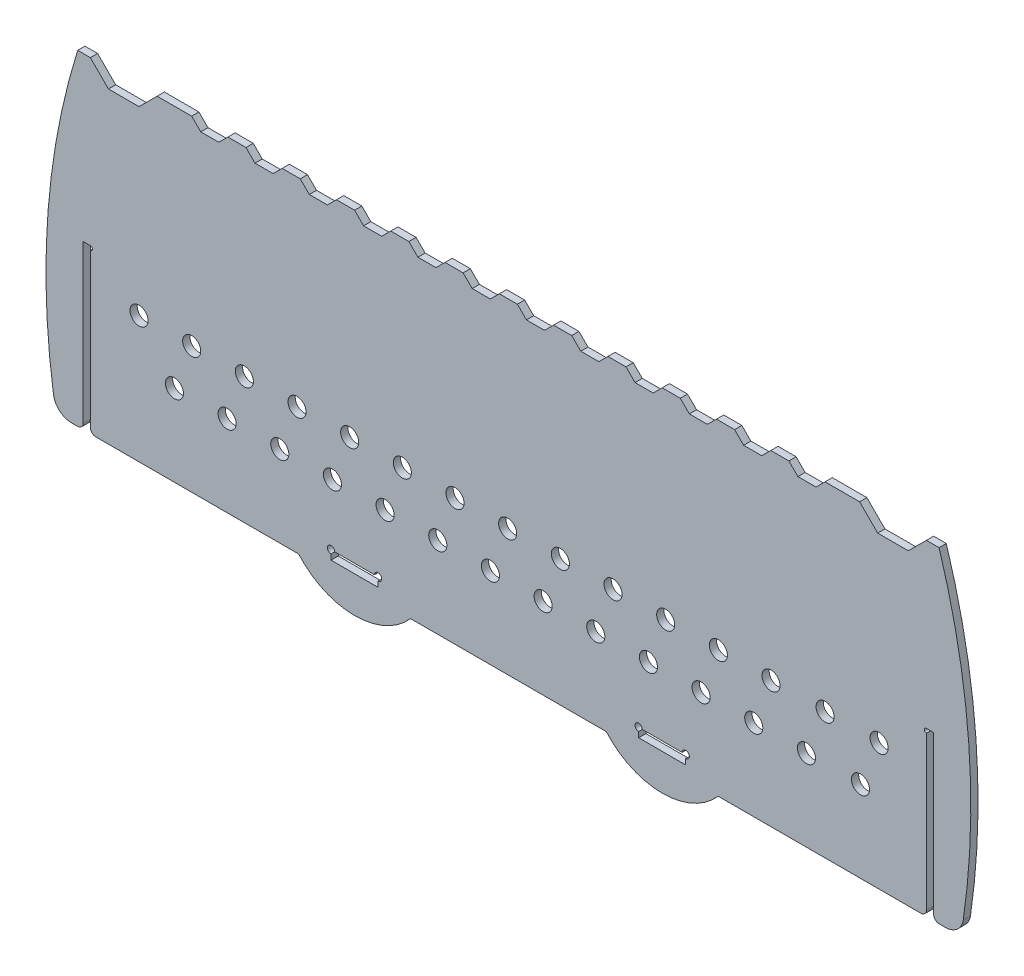
from build123d import *

# Parameters (mm, degrees)
SKETCH_1_R      = 5
EXTRUDE_1_DEPTH = 4


with BuildPart() as part:
    # Эскиз1 → Бобышка-Вытянуть1 (new body)
    with BuildSketch(Plane.XY):
        with BuildLine():
            Line((8.526879851, 0), (12, 0))
            ThreePointArc((12, 0), (14.121320344, 0.878679656), (15, 3))
            Line((15, 3), (15, 90))
            Line((15, 90), (19, 90))
            ThreePointArc((19, 90), (20.154255418, 88.845744582), (19, 87.691489165))
            Line((19, 87.691489165), (19, 3))
            ThreePointArc((19, 3), (19.878679656, 0.878679656), (22, 0))
            Line((22, 0), (134.07411748, 0))
            ThreePointArc((134.07411748, 0), (165, -14), (195.92588252, 0))
            Line((195.92588252, 0), (304.07411748, 0))
            ThreePointArc((304.07411748, 0), (335, -14), (365.92588252, 0))
            Line((365.92588252, 0), (478, 0))
            ThreePointArc((478, 0), (480.121320344, 0.878679656), (481, 3))
            Line((481, 3), (481, 87.691489165))
            ThreePointArc((481, 87.691489165), (479.845744582, 88.845744582), (481, 90))
            Line((481, 90), (485, 90))
            Line((485, 90), (485, 3))
            ThreePointArc((485, 3), (485.878679656, 0.878679656), (488, 0))
            Line((488, 0), (491.473120149, 0))
            ThreePointArc((491.473120149, 0), (498.004324615, 2.427459592), (501.364682095, 8.531326355))
            ThreePointArc((501.364682095, 8.531326355), (504.376413281, 95.021242555), (488, 180))
            Line((488, 180), (481, 180))
            Line((481, 180), (471, 170))
            Line((471, 170), (454.102752641, 170))
            Line((454.102752641, 170), (444.102752641, 180))
            Line((444.102752641, 180), (425, 180))
            Line((425, 180), (420, 175))
            Line((420, 175), (410, 175))
            Line((410, 175), (405, 180))
            Line((405, 180), (395, 180))
            Line((395, 180), (390, 175))
            Line((390, 175), (380, 175))
            Line((380, 175), (375, 180))
            Line((375, 180), (365, 180))
            Line((365, 180), (360, 175))
            Line((360, 175), (350, 175))
            Line((350, 175), (345, 180))
            Line((345, 180), (335, 180))
            Line((335, 180), (330, 175))
            Line((330, 175), (320, 175))
            Line((320, 175), (315, 180))
            Line((315, 180), (305, 180))
            Line((305, 180), (300, 175))
            Line((300, 175), (290, 175))
            Line((290, 175), (285, 180))
            Line((285, 180), (275, 180))
            Line((275, 180), (270, 175))
            Line((270, 175), (260, 175))
            Line((260, 175), (255, 180))
            Line((255, 180), (245, 180))
            Line((245, 180), (240, 175))
            Line((240, 175), (230, 175))
            Line((230, 175), (225, 180))
            Line((225, 180), (215, 180))
            Line((215, 180), (210, 175))
            Line((210, 175), (200, 175))
            Line((200, 175), (195, 180))
            Line((195, 180), (185, 180))
            Line((185, 180), (180, 175))
            Line((180, 175), (170, 175))
            Line((170, 175), (165, 180))
            Line((165, 180), (155, 180))
            Line((155, 180), (150, 175))
            Line((150, 175), (140, 175))
            Line((140, 175), (135, 180))
            Line((135, 180), (125, 180))
            Line((125, 180), (120, 175))
            Line((120, 175), (110, 175))
            Line((110, 175), (105, 180))
            Line((105, 180), (95, 180))
            Line((95, 180), (90, 175))
            Line((90, 175), (80, 175))
            Line((80, 175), (75, 180))
            Line((75, 180), (55.897247359, 180))
            Line((55.897247359, 180), (45.897247359, 170))
            Line((45.897247359, 170), (29, 170))
            Line((29, 170), (19, 180))
            Line((19, 180), (12, 180))
            ThreePointArc((12, 180), (-4.376413281, 95.021242555), (-1.364682095, 8.531326355))
            ThreePointArc((-1.364682095, 8.531326355), (1.995675385, 2.427459592), (8.526879851, 0))
        make_face()
        with Locations((45.897247359, 70)):
            Circle(SKETCH_1_R, mode=Mode.SUBTRACT)
        with Locations((65.46620575, 45)):
            Circle(SKETCH_1_R, mode=Mode.SUBTRACT)
        with Locations((75, 70)):
            Circle(SKETCH_1_R, mode=Mode.SUBTRACT)
        with Locations((94.568958391, 45)):
            Circle(SKETCH_1_R, mode=Mode.SUBTRACT)
        with Locations((104.102752641, 70)):
            Circle(SKETCH_1_R, mode=Mode.SUBTRACT)
        with Locations((123.671711032, 45)):
            Circle(SKETCH_1_R, mode=Mode.SUBTRACT)
        with Locations((133.205505282, 70)):
            Circle(SKETCH_1_R, mode=Mode.SUBTRACT)
        with Locations((152.774463674, 45)):
            Circle(SKETCH_1_R, mode=Mode.SUBTRACT)
        with Locations((162.308257923, 70)):
            Circle(SKETCH_1_R, mode=Mode.SUBTRACT)
        with Locations((181.877216315, 45)):
            Circle(SKETCH_1_R, mode=Mode.SUBTRACT)
        with Locations((191.411010565, 70)):
            Circle(SKETCH_1_R, mode=Mode.SUBTRACT)
        with Locations((210.979968956, 45)):
            Circle(SKETCH_1_R, mode=Mode.SUBTRACT)
        with Locations((220.513763206, 70)):
            Circle(SKETCH_1_R, mode=Mode.SUBTRACT)
        with Locations((240.082721597, 45)):
            Circle(SKETCH_1_R, mode=Mode.SUBTRACT)
        with Locations((249.616515847, 70)):
            Circle(SKETCH_1_R, mode=Mode.SUBTRACT)
        with Locations((269.185474238, 45)):
            Circle(SKETCH_1_R, mode=Mode.SUBTRACT)
        with Locations((278.719268488, 70)):
            Circle(SKETCH_1_R, mode=Mode.SUBTRACT)
        with Locations((298.288226879, 45)):
            Circle(SKETCH_1_R, mode=Mode.SUBTRACT)
        with Locations((307.822021129, 70)):
            Circle(SKETCH_1_R, mode=Mode.SUBTRACT)
        with Locations((327.39097952, 45)):
            Circle(SKETCH_1_R, mode=Mode.SUBTRACT)
        with Locations((336.92477377, 70)):
            Circle(SKETCH_1_R, mode=Mode.SUBTRACT)
        with Locations((356.493732162, 45)):
            Circle(SKETCH_1_R, mode=Mode.SUBTRACT)
        with Locations((366.027526411, 70)):
            Circle(SKETCH_1_R, mode=Mode.SUBTRACT)
        with Locations((385.596484803, 45)):
            Circle(SKETCH_1_R, mode=Mode.SUBTRACT)
        with Locations((395.130279053, 70)):
            Circle(SKETCH_1_R, mode=Mode.SUBTRACT)
        with Locations((414.699237444, 45)):
            Circle(SKETCH_1_R, mode=Mode.SUBTRACT)
        with Locations((425, 70)):
            Circle(SKETCH_1_R, mode=Mode.SUBTRACT)
        with Locations((444.568958391, 45)):
            Circle(SKETCH_1_R, mode=Mode.SUBTRACT)
        with Locations((454.869720947, 70)):
            Circle(SKETCH_1_R, mode=Mode.SUBTRACT)
        with BuildLine():
            Line((152, 6), (178, 6))
            Line((178, 6), (178, 9))
            ThreePointArc((178, 9), (179.414213562, 12.414213562), (176, 11))
            Line((176, 11), (154, 11))
            ThreePointArc((154, 11), (150.585786438, 12.414213562), (152, 9))
            Line((152, 9), (152, 6))
        make_face(mode=Mode.SUBTRACT)
        with BuildLine():
            Line((322, 6), (348, 6))
            Line((348, 6), (348, 9))
            ThreePointArc((348, 9), (349.414213562, 12.414213562), (346, 11))
            Line((346, 11), (324, 11))
            ThreePointArc((324, 11), (320.585786438, 12.414213562), (322, 9))
            Line((322, 9), (322, 6))
        make_face(mode=Mode.SUBTRACT)
    extrude(amount=EXTRUDE_1_DEPTH)


solid = part.part
